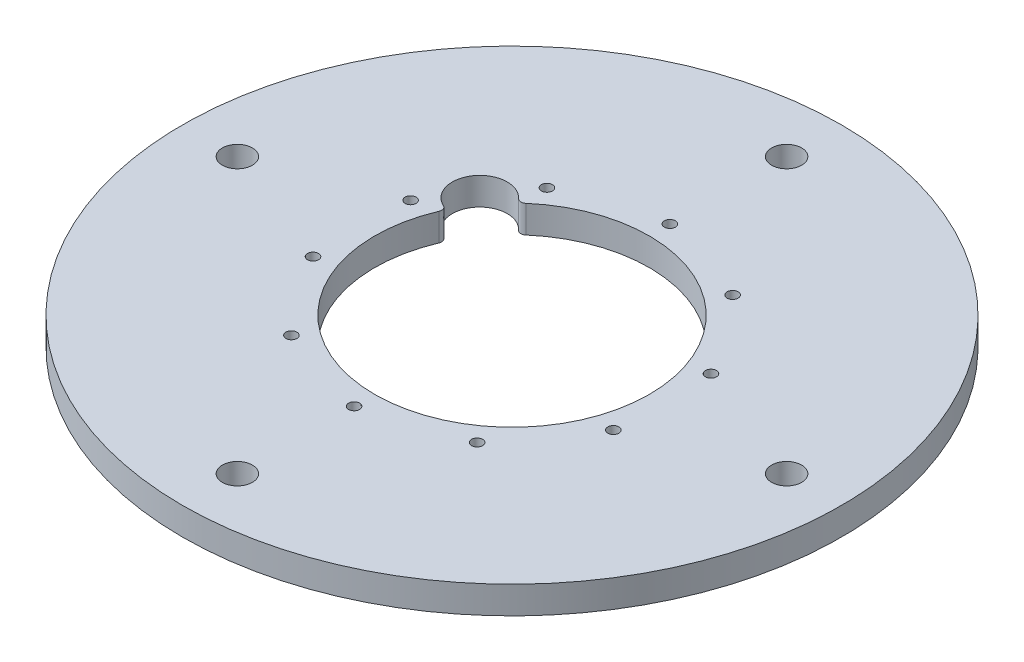
from build123d import *

# Parameters (mm, degrees)
SKETCH1_R                           = 152.4
SKETCH1_R_2                         = 63.5
THRUSTPLATE_TC3_DEPTH               = 12.7
UNDEF_CLEARANCE_THRUSTPLATE_D       = 13.89126
CLEARANCE_THRUSTPLATE_PATTERN_COUNT = 4
F_10_CLEARANCE_HOLE1_D              = 5.1054
CIRPATTERN1_COUNT                   = 10
CUT_EXTRUDE1_REACH                  = 217.9


with BuildPart() as part:
    # Sketch1 → ThrustPlate_TC3 (new body)
    with BuildSketch(Plane(origin=(0, 0, 0), x_dir=(1, 0, 0), z_dir=(0, 1, 0))):
        with Locations(Location((0, 0, 0), (0, 0, 270))):
            Circle(SKETCH1_R)
        with Locations(Location((0, 0, 0), (0, 0, 270))):
            Circle(SKETCH1_R_2, mode=Mode.SUBTRACT)
    extrude(amount=-THRUSTPLATE_TC3_DEPTH)

    # UNDEF_Clearance_ThrustPlate (through all)
    with Locations(Plane(origin=(0, 0, 0), x_dir=(1, 0, 0), z_dir=(0, 1, 0))):
        with Locations((0, 127)):
            undef_clearance_thrustplate = Hole(UNDEF_CLEARANCE_THRUSTPLATE_D / 2)

    # Clearance_ThrustPlate_Pattern: UNDEF_Clearance_ThrustPlate ×4 about axis
    clearance_thrustplate_pattern_axis = Axis((0, 0, 0), (0, 1, 0))
    for i in range(1, CLEARANCE_THRUSTPLATE_PATTERN_COUNT):
        add(undef_clearance_thrustplate.rotate(clearance_thrustplate_pattern_axis, i * 360 / CLEARANCE_THRUSTPLATE_PATTERN_COUNT), mode=Mode.SUBTRACT)

    # #10 Clearance Hole1 (through all)
    with Locations(Plane(origin=(0, 0, 0), x_dir=(1, 0, 0), z_dir=(0, 1, 0))):
        with Locations((0, 73.025)):
            f_10_clearance_hole1 = Hole(F_10_CLEARANCE_HOLE1_D / 2)

    # CirPattern1: #10 Clearance Hole1 ×10 about axis
    cirpattern1_axis = Axis((0, 0, 0), (0, 1, 0))
    for i in range(1, CIRPATTERN1_COUNT):
        add(f_10_clearance_hole1.rotate(cirpattern1_axis, i * 360 / CIRPATTERN1_COUNT), mode=Mode.SUBTRACT)

    # Sketch24 → Cut-Extrude1 (cut, up to next)
    with BuildSketch(Plane(origin=(0, 0, 0), x_dir=(1, 0, 0), z_dir=(0, 1, 0)), mode=Mode.PRIVATE) as cut_extrude1_sk1:
        with BuildLine():
            ThreePointArc((-45.123199962, 48.17827493), (-64.72944972, 47.028698036), (-59.764097944, 28.026807647))
            ThreePointArc((-59.764097944, 28.026807647), (-58.45757522, 26.637277771), (-58.48647188, 24.73019626))
            ThreePointArc((-58.48647188, 24.73019626), (-51.372579143, 37.324363521), (-41.593128054, 47.981889278))
            ThreePointArc((-41.593128054, 47.981889278), (-43.397940793, 47.365086324), (-45.123199962, 48.17827493))
        make_face()
    cut_extrude1_tool1 = extrude(cut_extrude1_sk1.sketch, amount=-CUT_EXTRUDE1_REACH, mode=Mode.PRIVATE) & part.part
    add(cut_extrude1_tool1.solids().sort_by_distance((-57.000167, 0, -41.413046))[0], mode=Mode.SUBTRACT)


solid = part.part
